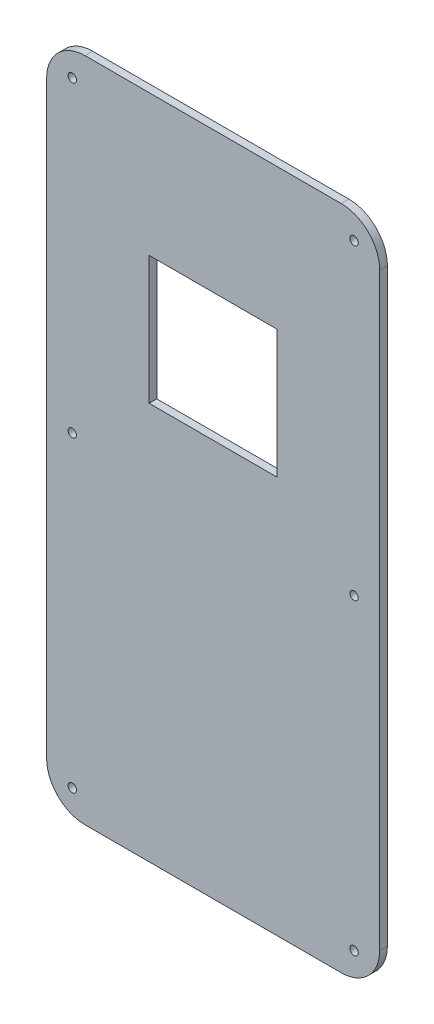
from build123d import *

# Parameters (mm, degrees)
SKETCH_1_W          = 130
SKETCH_1_H          = 260
EXTRUDE_1_DEPTH     = 3
SKETCH_2_R          = 1.65
SKETCH_2_R_2        = 1.6
SKETCH_2_R_3        = 1.605
CUT_EXTRUDE_1_DEPTH = 3
SKETCH_3_W          = 50
SKETCH_3_H          = 50
CUT_EXTRUDE_2_DEPTH = 10
FILLET_1_R          = 15


with BuildPart() as part:
    # 草图1 → 凸台-拉伸1 (new body)
    with BuildSketch(Plane.XY):
        with Locations((65, 130)):
            Rectangle(SKETCH_1_W, SKETCH_1_H)
    extrude(amount=EXTRUDE_1_DEPTH)

    # 草图2 → 切除-拉伸1 (cut)
    with BuildSketch(Plane.XY.offset(3)):
        with Locations((120, 10)):
            Circle(SKETCH_2_R)
        with Locations((10, 10)):
            Circle(SKETCH_2_R)
        with Locations(Location((10, 250, 0), (0, 0, 180))):
            Circle(SKETCH_2_R)
        with Locations(Location((120, 250, 0), (0, 0, 180))):
            Circle(SKETCH_2_R)
        with Locations((120, 130)):
            Circle(SKETCH_2_R_2)
        with Locations((10, 130)):
            Circle(SKETCH_2_R_3)
    extrude(amount=-CUT_EXTRUDE_1_DEPTH, mode=Mode.SUBTRACT)

    # 草图3 → 切除-拉伸2 (cut)
    with BuildSketch(Plane(origin=(0, 0, 0), x_dir=(-1, 0, 0), z_dir=(0, 0, -1))):
        with Locations((-65, 180)):
            Rectangle(SKETCH_3_W, SKETCH_3_H)
    extrude(amount=-CUT_EXTRUDE_2_DEPTH, mode=Mode.SUBTRACT)

    # 圆角1
    fillet_1_edges = [part.edges().sort_by_distance(p)[0] for p in [
        (0, 0, 1.5),
        (130, 0, 1.5),
        (130, 260, 1.5),
        (0, 260, 1.5),
    ]]
    fillet(fillet_1_edges, radius=FILLET_1_R)


solid = part.part
